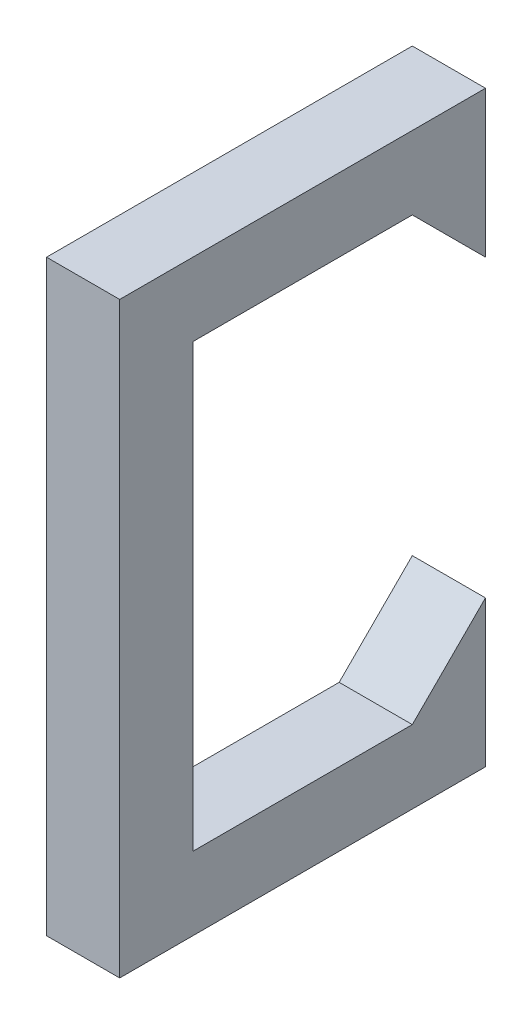
from build123d import *

# Parameters (mm, degrees)
SKETCH1_W           = 1.5
SKETCH1_H           = 9.05
SKETCH1_H_2         = 1.5
BOSS_EXTRUDE1_DEPTH = 1.5
SKETCH1_3_W         = 1.5
SKETCH1_3_H         = 1.5
BOSS_EXTRUDE2_DEPTH = 6
BOSS_EXTRUDE3_DEPTH = 1.5


with BuildPart() as part:
    # Sketch1 → Boss-Extrude1 (new body)
    with BuildSketch(Plane.XY):
        with Locations((0.75, 4.525)):
            Rectangle(SKETCH1_W, SKETCH1_H)
        with Locations((0.75, 9.8)):
            Rectangle(SKETCH1_W, SKETCH1_H_2)
        with Locations((0.75, -0.75)):
            Rectangle(SKETCH1_W, SKETCH1_H_2)
    extrude(amount=BOSS_EXTRUDE1_DEPTH)

    # Sketch1<3> → Boss-Extrude2 (add)
    with BuildSketch(Plane.XY):
        with Locations((0.75, 9.8)):
            Rectangle(SKETCH1_3_W, SKETCH1_3_H)
        with Locations((0.75, -0.75)):
            Rectangle(SKETCH1_3_W, SKETCH1_3_H)
    extrude(amount=-BOSS_EXTRUDE2_DEPTH)

    # Sketch2 → Boss-Extrude3 (add)
    with BuildSketch(Plane(origin=(1.5, 0, 0), x_dir=(0, 0, -1), z_dir=(1, 0, 0))):
        Polygon((4.5, 9.05), (6, 7.55), (6, 9.05), align=None)
        Polygon((6, 0), (4.5, 0), (6, 1.5), align=None)
    extrude(amount=-BOSS_EXTRUDE3_DEPTH)


solid = part.part
